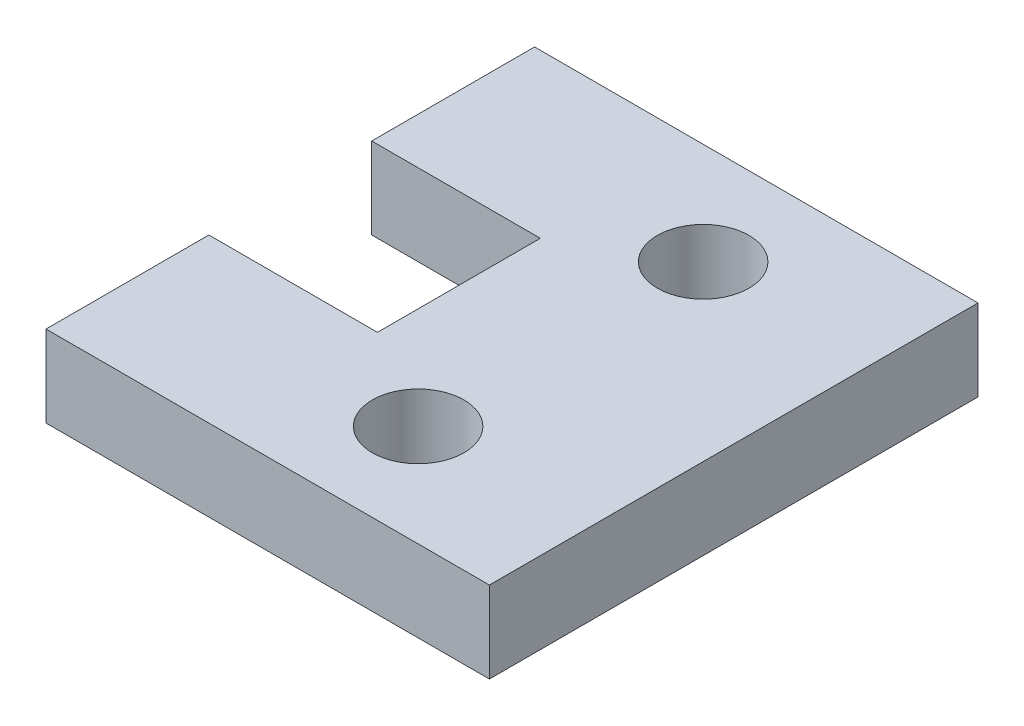
from build123d import *

# Parameters (mm, degrees)
SKETCH1_3_R         = 2.25
BOSS_EXTRUDE2_DEPTH = 4


with BuildPart() as part:
    # Sketch1<3> → Boss-Extrude2 (new body)
    with BuildSketch(Plane(origin=(0, 0, 0), x_dir=(1, 0, 0), z_dir=(0, 1, 0))):
        Polygon((-13.279945991, -4), (-13.279945991, -12), (8.5, -12), (8.5, 12), (-13.279945991, 12), (-13.279945991, 4), (-5, 4), (-5, -4), align=None)
        with Locations((0, -7)):
            Circle(SKETCH1_3_R, mode=Mode.SUBTRACT)
        with Locations((0, 7)):
            Circle(SKETCH1_3_R, mode=Mode.SUBTRACT)
    extrude(amount=BOSS_EXTRUDE2_DEPTH)


solid = part.part
